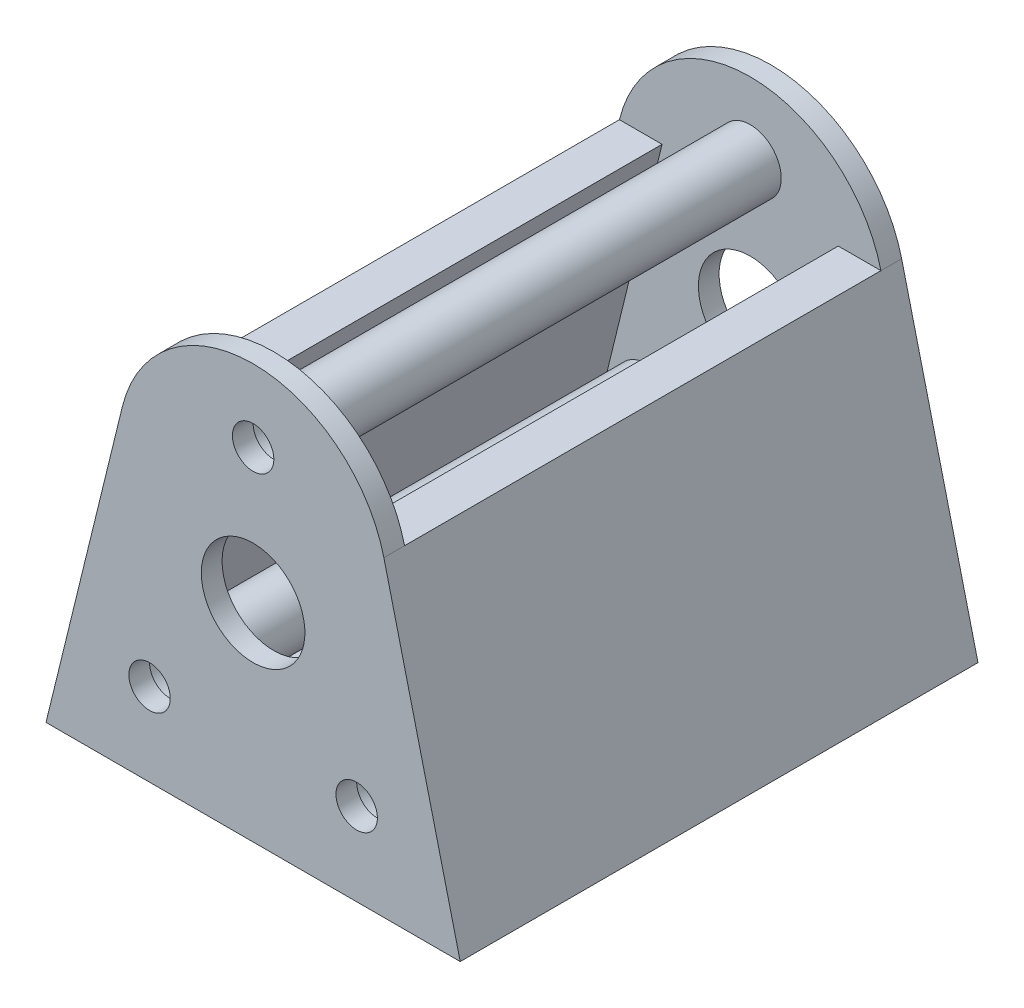
from build123d import *

# Parameters (mm, degrees)
SKETCH1_R           = 5
SKETCH1_R_2         = 2
BOSS_EXTRUDE1_DEPTH = 2
SKETCH2_R           = 5
SKETCH2_R_2         = 2
BOSS_EXTRUDE2_DEPTH = 2
SKETCH4_R           = 3
SKETCH4_R_2         = 2.5
BOSS_EXTRUDE3_DEPTH = 46
BOSS_EXTRUDE4_DEPTH = 46
BOSS_EXTRUDE5_DEPTH = 46
SKETCH9_R           = 5
SKETCH9_R_2         = 2.5
BOSS_EXTRUDE6_DEPTH = 5


with BuildPart() as part:
    # Sketch1 → Boss-Extrude1 (new body)
    with BuildSketch(Plane.XY):
        with BuildLine():
            Line((-20, 0), (20, 0))
            Line((20, 0), (12.626516595, 30.093715997))
            ThreePointArc((12.626516595, 30.093715997), (0, 40), (-12.626516595, 30.093715997))
            Line((-12.626516595, 30.093715997), (-20, 0))
        make_face()
        with Locations((0, 20)):
            Circle(SKETCH1_R, mode=Mode.SUBTRACT)
        with Locations((0, 33)):
            Circle(SKETCH1_R_2, mode=Mode.SUBTRACT)
        with Locations((10, 8)):
            Circle(SKETCH1_R_2, mode=Mode.SUBTRACT)
        with Locations((-10, 8)):
            Circle(SKETCH1_R_2, mode=Mode.SUBTRACT)
    extrude(amount=BOSS_EXTRUDE1_DEPTH)



with BuildPart() as body_2:
    # Sketch2 → Boss-Extrude2 (new body)
    with BuildSketch(Plane(origin=(0, 0, 50), x_dir=(-1, 0, 0), z_dir=(0, 0, -1))):
        with BuildLine():
            Line((-12.626516595, 30.093715997), (-20, 0))
            Line((-20, 0), (20, 0))
            Line((20, 0), (12.626516595, 30.093715997))
            ThreePointArc((12.626516595, 30.093715997), (0, 40), (-12.626516595, 30.093715997))
        make_face()
        with Locations(Location((0, 20, 0), (0, 0, 180))):
            Circle(SKETCH2_R, mode=Mode.SUBTRACT)
        with Locations(Location((0, 33, 0), (0, 0, 180))):
            Circle(SKETCH2_R_2, mode=Mode.SUBTRACT)
        with Locations(Location((10, 8, 0), (0, 0, 180))):
            Circle(SKETCH2_R_2, mode=Mode.SUBTRACT)
        with Locations(Location((-10, 8, 0), (0, 0, 180))):
            Circle(SKETCH2_R_2, mode=Mode.SUBTRACT)
    extrude(amount=BOSS_EXTRUDE2_DEPTH)


with BuildPart() as part_1:
    add(part.part)

    add(body_2.part)  # Boss-Extrude3 merges body 2
    # Sketch4 → Boss-Extrude3 (add)
    # profile 1 of 3: a face of its own
    with BuildSketch(Plane(origin=(0, 0, 48), x_dir=(-1, 0, 0), z_dir=(0, 0, -1))):
        with Locations(Location((10, 8, 0), (0, 0, 180))):
            Circle(SKETCH4_R)
        with Locations(Location((10, 8, 0), (0, 0, 180))):
            Circle(SKETCH4_R_2, mode=Mode.SUBTRACT)
    # profile 2 of 3: a face of its own
    with BuildSketch(Plane(origin=(0, 0, 48), x_dir=(-1, 0, 0), z_dir=(0, 0, -1))):
        with Locations(Location((0, 33, 0), (0, 0, 180))):
            Circle(SKETCH4_R)
        with Locations(Location((0, 33, 0), (0, 0, 180))):
            Circle(SKETCH4_R_2, mode=Mode.SUBTRACT)
    # profile 3 of 3: a face of its own
    with BuildSketch(Plane(origin=(0, 0, 48), x_dir=(-1, 0, 0), z_dir=(0, 0, -1))):
        with Locations(Location((-10, 8, 0), (0, 0, 180))):
            Circle(SKETCH4_R)
        with Locations(Location((-10, 8, 0), (0, 0, 180))):
            Circle(SKETCH4_R_2, mode=Mode.SUBTRACT)
    extrude(amount=BOSS_EXTRUDE3_DEPTH)

    # Sketch5 → Boss-Extrude4 (add)
    with BuildSketch(Plane(origin=(0, 0, 48), x_dir=(-1, 0, 0), z_dir=(0, 0, -1))):
        Polygon((-20, 0), (20, 0), (19.019930486, 4), (-19.019930486, 4), align=None)
    extrude(amount=BOSS_EXTRUDE4_DEPTH)

    # Sketch6 → Boss-Extrude5 (add)
    with BuildSketch(Plane(origin=(0, 0, 48), x_dir=(-1, 0, 0), z_dir=(0, 0, -1))):
        Polygon((19.019930486, 4), (12.626516595, 30.093715997), (8.508199433, 30.093715997), (14.901613323, 4), align=None)
        Polygon((-19.019930486, 4), (-14.901613323, 4), (-8.508199433, 30.093715997), (-12.626516595, 30.093715997), align=None)
    extrude(amount=BOSS_EXTRUDE5_DEPTH)

    # Sketch9 → Boss-Extrude6 (add)
    # profile 1 of 4: a face of its own
    with BuildSketch(Plane.XZ):
        with Locations(Location((-10, 12.5, 0), (0, 0, 90))):
            Circle(SKETCH9_R)
        with Locations(Location((-10, 12.5, 0), (0, 0, 270))):
            Circle(SKETCH9_R_2, mode=Mode.SUBTRACT)
    # profile 2 of 4: a face of its own
    with BuildSketch(Plane.XZ):
        with Locations(Location((-10, 37.5, 0), (0, 0, 90))):
            Circle(SKETCH9_R)
        with Locations(Location((-10, 37.5, 0), (0, 0, 90))):
            Circle(SKETCH9_R_2, mode=Mode.SUBTRACT)
    # profile 3 of 4: a face of its own
    with BuildSketch(Plane.XZ):
        with Locations(Location((10, 12.5, 0), (0, 0, 90))):
            Circle(SKETCH9_R)
        with Locations(Location((10, 12.5, 0), (0, 0, 90))):
            Circle(SKETCH9_R_2, mode=Mode.SUBTRACT)
    # profile 4 of 4: a face of its own
    with BuildSketch(Plane.XZ):
        with Locations(Location((10, 37.5, 0), (0, 0, 90))):
            Circle(SKETCH9_R)
        with Locations(Location((10, 37.5, 0), (0, 0, 270))):
            Circle(SKETCH9_R_2, mode=Mode.SUBTRACT)
    extrude(amount=BOSS_EXTRUDE6_DEPTH)


solid = part_1.part
